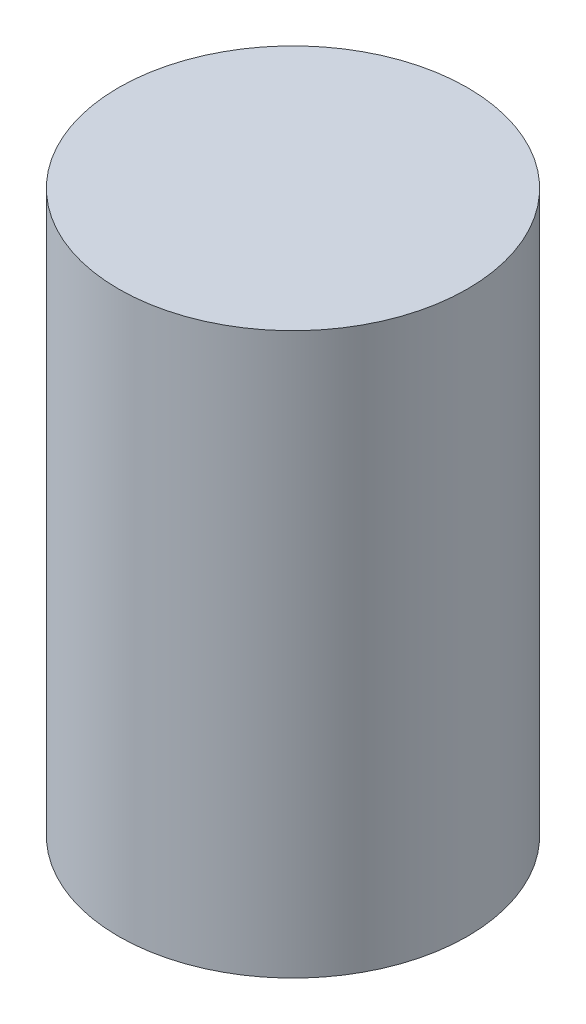
from build123d import *

# Parameters (mm, degrees)
SKETCH1_W = 112
SKETCH1_H = 360


with BuildPart() as part:
    # Sketch1 → Revolve1 (revolve)
    with BuildSketch(Plane.XY, mode=Mode.PRIVATE) as revolve1_sk:
        with Locations((56, -180)):
            Rectangle(SKETCH1_W, SKETCH1_H)
    revolve(revolve1_sk.sketch.rotate(Axis((0, 0, 0), (0, 1, 0)), 90), axis=Axis((0, 0, 0), (0, 1, 0)))


solid = part.part
